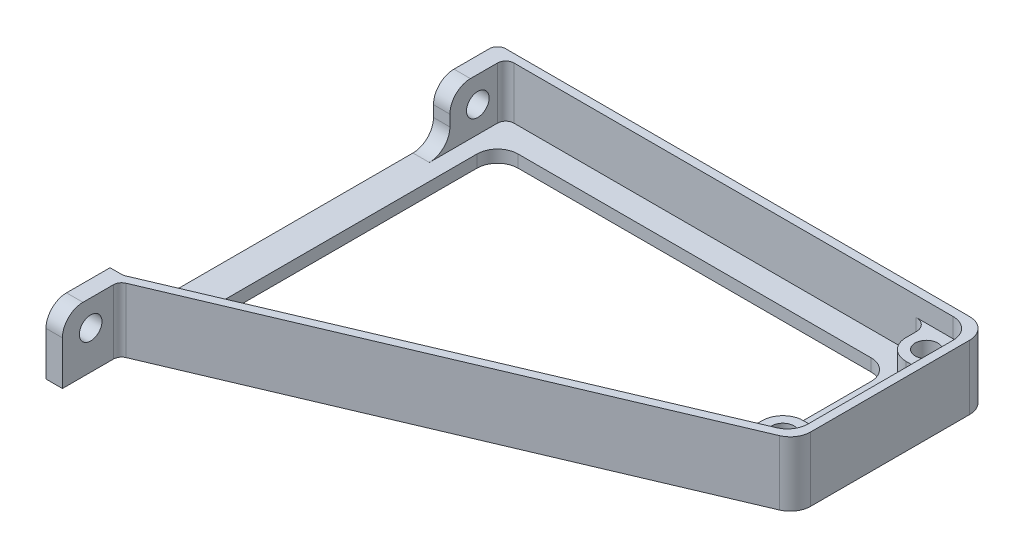
from build123d import *

# Parameters (mm, degrees)
BOSS_EXTRUDE1_DEPTH = 3
SKETCH2_R           = 2.75
CUT_EXTRUDE3_DEPTH  = 163.815846895
BOSS_EXTRUDE3_DEPTH = 12.7
BOSS_EXTRUDE4_START = 8
SKETCH8_R           = 2.75
BOSS_EXTRUDE4_DEPTH = 8
SKETCH9_W           = 4
SKETCH9_H           = 15.601931027
BOSS_EXTRUDE5_DEPTH = 12.7
SKETCH10_R          = 2.75
CUT_EXTRUDE4_DEPTH  = 110.875
FILLET3_R           = 5
SKETCH11_R          = 5
CUT_EXTRUDE5_DEPTH  = 15.875
FILLET4_R           = 2
FILLET5_R           = 3
FILLET7_R           = 2


with BuildPart() as part:
    # Sketch1 → Boss-Extrude1 (new body)
    with BuildSketch(Plane(origin=(0, 0, 0), x_dir=(1, 0, 0), z_dir=(0, 1, 0))):
        Polygon((0, 0), (120, 0), (120, -47), (4, -96.23907868), (4, -110), (0, -110), align=None)
    extrude(amount=BOSS_EXTRUDE1_DEPTH)

    # Sketch2 → Cut-Extrude3 (cut, through all)
    with BuildSketch(Plane(origin=(0, 3, 0), x_dir=(1, 0, 0), z_dir=(0, 1, 0))):
        with Locations(Location((112, -7.5, 0), (0, 0, 270))):
            Circle(SKETCH2_R)
        with Locations(Location((112, -42.5, 0), (0, 0, 270))):
            Circle(SKETCH2_R)
        Polygon((104, -8), (104, -45.10071404), (8, -85.850296396), (8, -8), align=None)
    extrude(amount=-CUT_EXTRUDE3_DEPTH, mode=Mode.SUBTRACT)

    # Sketch7 → Boss-Extrude3 (add)
    with BuildSketch(Plane(origin=(0, 3, 0), x_dir=(1, 0, 0), z_dir=(0, 1, 0))):
        Polygon((118, -45.676228878), (3.218537743, -94.398068973), (4, -96.23907868), (120, -47), (120, 0), (3.218537743, 0), (3.218537743, -2), (118, -2), align=None)
    extrude(amount=BOSS_EXTRUDE3_DEPTH)

    # Sketch8 → Boss-Extrude4 (add)
    # profile 1 of 2: a face of its own
    with BuildSketch(Plane(origin=(0, 3, 0), x_dir=(1, 0, 0), z_dir=(0, 1, 0)).offset(BOSS_EXTRUDE4_START)):
        with BuildLine():
            Line((112, -12.5), (118, -12.5))
            Line((118, -12.5), (118, -2))
            Line((118, -2), (107, -2))
            Line((107, -2), (107, -7.5))
            ThreePointArc((107, -7.5), (108.464466094, -11.035533906), (112, -12.5))
        make_face()
        with Locations(Location((112, -7.5, 0), (0, 0, 270))):
            Circle(SKETCH8_R, mode=Mode.SUBTRACT)
    # profile 2 of 2: a face of its own
    with BuildSketch(Plane(origin=(0, 3, 0), x_dir=(1, 0, 0), z_dir=(0, 1, 0)).offset(BOSS_EXTRUDE4_START)):
        with BuildLine():
            Line((112, -37.5), (118, -37.5))
            Line((118, -37.5), (118, -45.676228878))
            Line((118, -45.676228878), (107, -50.345451856))
            Line((107, -50.345451856), (107, -42.5))
            ThreePointArc((107, -42.5), (108.464466094, -38.964466094), (112, -37.5))
        make_face()
        with Locations(Location((112, -42.5, 0), (0, 0, 270))):
            Circle(SKETCH8_R, mode=Mode.SUBTRACT)
    extrude(amount=-BOSS_EXTRUDE4_DEPTH)

    # Sketch9 → Boss-Extrude5 (add)
    with BuildSketch(Plane(origin=(0, 3, 0), x_dir=(1, 0, 0), z_dir=(0, 1, 0))):
        with Locations((2, -7.800965514)):
            Rectangle(SKETCH9_W, SKETCH9_H)
        with Locations((2, -102.199034487)):
            Rectangle(SKETCH9_W, SKETCH9_H)
    extrude(amount=BOSS_EXTRUDE5_DEPTH)

    # Sketch10 → Cut-Extrude4 (cut)
    with BuildSketch(Plane(origin=(4, 0, 0), x_dir=(0, 0, -1), z_dir=(1, 0, 0))):
        with Locations((-8.800965513, 9.35)):
            Circle(SKETCH10_R)
        with Locations((-103.11953934, 9.35)):
            Circle(SKETCH10_R)
    extrude(amount=-CUT_EXTRUDE4_DEPTH, mode=Mode.SUBTRACT)

    # Fillet3
    fillet3_edges = [part.edges().sort_by_distance(p)[0] for p in [
        (120, 7.85, 0),
        (120, 7.85, 47),
        (2, 3, 15.601931027),
        (2, 15.7, 15.601931027),
        (2, 15.7, 110),
        (8, 1.5, 8),
        (104, 1.5, 8),
        (104, 1.5, 45.10071404),
        (8, 1.5, 85.850296396),
        (118, 13.35, 2),
        (118, 13.35, 45.676228878),
    ]]
    fillet(fillet3_edges, radius=FILLET3_R)

    # Sketch11 → Cut-Extrude5 (cut)
    with BuildSketch(Plane(origin=(0, 3, 0), x_dir=(1, 0, 0), z_dir=(0, 1, 0))):
        with Locations(Location((112, -25, 0), (0, 0, 270))):
            Circle(SKETCH11_R)
    extrude(amount=-CUT_EXTRUDE5_DEPTH, mode=Mode.SUBTRACT)

    # Fillet4
    fillet4_edges = [part.edges().sort_by_distance(p)[0] for p in [
        (4, 7.85, 96.23907868),
        (4, 9.35, 2),
    ]]
    fillet(fillet4_edges, radius=FILLET4_R)

    # Fillet5
    fillet5_edges = [part.edges().sort_by_distance(p)[0] for p in [
        (107, 7, 50.345451856),
        (118, 7, 37.5),
        (118, 7, 12.5),
        (107, 7, 2),
    ]]
    fillet(fillet5_edges, radius=FILLET5_R)

    # Fillet7
    fillet7_edges = [part.edges().sort_by_distance(p)[0] for p in [
        (0, 7.85, 0),
        (3.218537743, 9.35, 94.398068973),
    ]]
    fillet(fillet7_edges, radius=FILLET7_R)


solid = part.part
